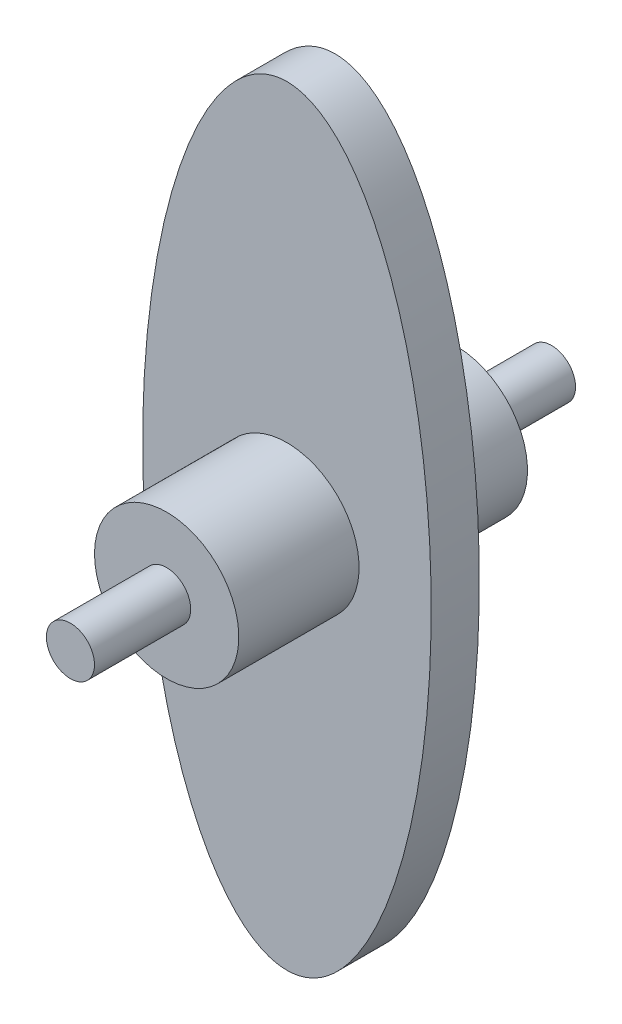
from build123d import *

# Parameters (mm, degrees)
SKETCH1_RX          = 50.8
SKETCH1_RY          = 19.05
BOSS_EXTRUDE1_DEPTH = 3.175
SKETCH3_R           = 9.525
BOSS_EXTRUDE3_DEPTH = 19.05
SKETCH4_R           = 3.175
BOSS_EXTRUDE4_DEPTH = 31.75


with BuildPart() as part:
    # Sketch1 → Boss-Extrude1 (new, symmetric)
    with BuildSketch(Plane.XY):
        with Locations(Location((0, 0), (0, 0, 90))):
            Ellipse(SKETCH1_RX, SKETCH1_RY)
    extrude(amount=BOSS_EXTRUDE1_DEPTH, both=True)

    # Sketch3 → Boss-Extrude3 (add, symmetric)
    with BuildSketch(Plane.XY):
        with Locations(Location((0, 0, 0), (0, 0, 180))):
            Circle(SKETCH3_R)
    extrude(amount=BOSS_EXTRUDE3_DEPTH, both=True)

    # Sketch4 → Boss-Extrude4 (add, symmetric)
    with BuildSketch(Plane.XY):
        Circle(SKETCH4_R)
    extrude(amount=BOSS_EXTRUDE4_DEPTH, both=True)


solid = part.part
